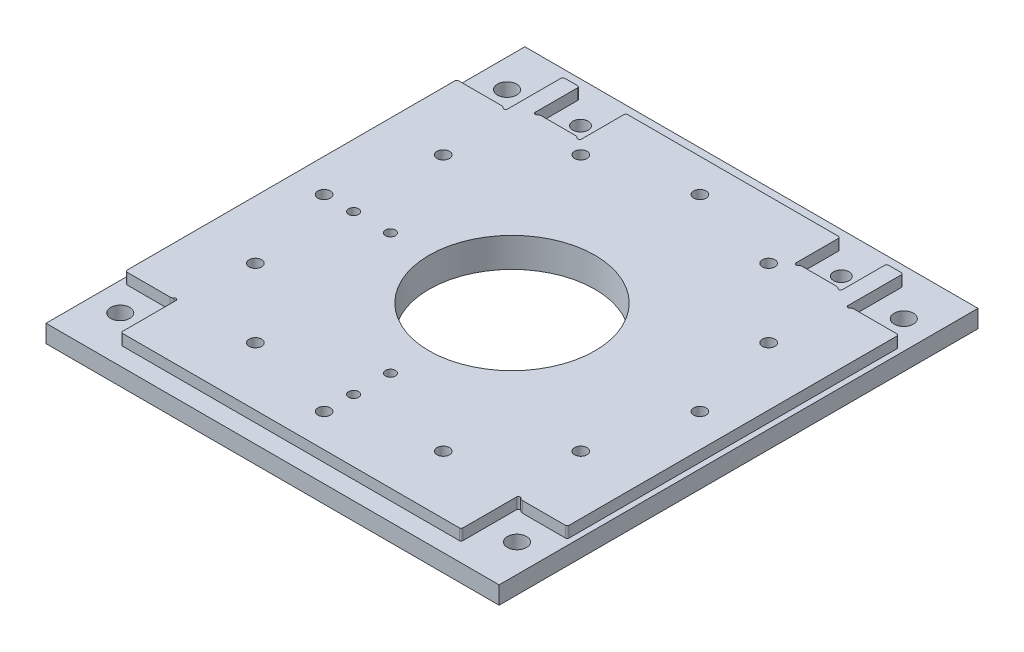
from build123d import *

# Parameters (mm, degrees)
SKETCH_1_W           = 120
SKETCH_1_H           = 120
EXTRUDE_1_DEPTH      = 3
SKETCH_2_W           = 123
SKETCH_2_H           = 128
EXTRUDE_2_DEPTH      = 5
SKETCH_4_R           = 22.5
CUT_EXTRUDE_2_DEPTH  = 90.119302062
SKETCH_5_W           = 15.3
SKETCH_5_H           = 19
SKETCH_5_W_2         = 12.6
SKETCH_5_H_2         = 16
CUT_EXTRUDE_3_DEPTH  = 3
SKETCH_3_R           = 1.7
CUT_EXTRUDE_5_DEPTH  = 90.119302062
SKETCH_15_R          = 1.35
CUT_EXTRUDE_7_DEPTH  = 90.119302062
SKETCH_20_R          = 2.6
SKETCH_20_R_2        = 2.1
CUT_EXTRUDE_14_DEPTH = 90.119302062
SKETCH_21_R          = 5.5
SKETCH_21_R_2        = 4.6
CUT_EXTRUDE_15_DEPTH = 1
SKETCH_23_W          = 1
SKETCH_23_H          = 5
EXTRUDE_5_DEPTH      = 123
FILLET_1_R           = 0.5
SKETCH_25_R          = 0.5
CUT_EXTRUDE_17_DEPTH = 3
FILLET_2_R           = 1
CHAMFER_1_SIZE       = 0.2


with BuildPart() as part:
    # 草图1 → 凸台-拉伸1 (new body)
    with BuildSketch(Plane(origin=(0, 0, 0), x_dir=(1, 0, 0), z_dir=(0, 1, 0))):
        Rectangle(SKETCH_1_W, SKETCH_1_H)
    extrude(amount=EXTRUDE_1_DEPTH)

    # 草图2 → 凸台-拉伸2 (add)
    with BuildSketch(Plane.XZ):
        Rectangle(SKETCH_2_W, SKETCH_2_H)
    extrude(amount=EXTRUDE_2_DEPTH)

    # 草图4 → 切除-拉伸2 (cut, through all)
    with BuildSketch(Plane(origin=(0, 3, 0), x_dir=(1, 0, 0), z_dir=(0, 1, 0))):
        with Locations(Location((0, 0, 0), (0, 0, 270))):
            Circle(SKETCH_4_R)
    extrude(amount=-CUT_EXTRUDE_2_DEPTH, mode=Mode.SUBTRACT)

    # 草图5 → 切除-拉伸3 (cut)
    with BuildSketch(Plane(origin=(0, 3, 0), x_dir=(1, 0, 0), z_dir=(0, 1, 0))):
        with Locations((-53.85, 54.5)):
            Rectangle(SKETCH_5_W, SKETCH_5_H)
        with Locations((35.4, 56)):
            Rectangle(SKETCH_5_W_2, SKETCH_5_H_2)
        with Locations((53.85, 54.5)):
            Rectangle(SKETCH_5_W, SKETCH_5_H)
        with Locations((-35.4, 56)):
            Rectangle(SKETCH_5_W_2, SKETCH_5_H_2)
        with Locations((-53.85, -54.5)):
            Rectangle(SKETCH_5_W, SKETCH_5_H)
        with Locations((53.85, -54.5)):
            Rectangle(SKETCH_5_W, SKETCH_5_H)
    extrude(amount=-CUT_EXTRUDE_3_DEPTH, mode=Mode.SUBTRACT)

    # 草图3 → 切除-拉伸5 (cut, through all)
    with BuildSketch(Plane(origin=(0, 3, 0), x_dir=(1, 0, 0), z_dir=(0, 1, 0))):
        with Locations(Location((0, 51, 0), (0, 0, 270))):
            Circle(SKETCH_3_R)
        with Locations(Location((25.5, 44.167295593, 0), (0, 0, 270))):
            Circle(SKETCH_3_R)
        with Locations(Location((44.167295593, 25.5, 0), (0, 0, 270))):
            Circle(SKETCH_3_R)
        with Locations(Location((51, 0, 0), (0, 0, 270))):
            Circle(SKETCH_3_R)
        with Locations(Location((44.167295593, -25.5, 0), (0, 0, 270))):
            Circle(SKETCH_3_R)
        with Locations(Location((25.5, -44.167295593, 0), (0, 0, 270))):
            Circle(SKETCH_3_R)
        with Locations(Location((0, -51, 0), (0, 0, 270))):
            Circle(SKETCH_3_R)
        with Locations(Location((-25.5, -44.167295593, 0), (0, 0, 270))):
            Circle(SKETCH_3_R)
        with Locations(Location((-44.167295593, -25.5, 0), (0, 0, 270))):
            Circle(SKETCH_3_R)
        with Locations(Location((-51, 0, 0), (0, 0, 270))):
            Circle(SKETCH_3_R)
        with Locations(Location((-44.167295593, 25.5, 0), (0, 0, 270))):
            Circle(SKETCH_3_R)
        with Locations(Location((-25.5, 44.167295593, 0), (0, 0, 270))):
            Circle(SKETCH_3_R)
    extrude(amount=-CUT_EXTRUDE_5_DEPTH, mode=Mode.SUBTRACT)

    # 草图15 → 切除-拉伸7 (cut, through all)
    with BuildSketch(Plane(origin=(0, 3, 0), x_dir=(1, 0, 0), z_dir=(0, 1, 0))):
        with Locations(Location((0, -33, 0), (0, 0, 270))):
            Circle(SKETCH_15_R)
        with Locations(Location((0, -43, 0), (0, 0, 270))):
            Circle(SKETCH_15_R)
        with Locations(Location((-33, 0, 0), (0, 0, 270))):
            Circle(SKETCH_15_R)
        with Locations(Location((-43, 0, 0), (0, 0, 270))):
            Circle(SKETCH_15_R)
    extrude(amount=-CUT_EXTRUDE_7_DEPTH, mode=Mode.SUBTRACT)

    # 草图20 → 切除-拉伸14 (cut, through all)
    with BuildSketch(Plane(origin=(0, 3, 0), x_dir=(1, 0, 0), z_dir=(0, 1, 0))):
        with Locations(Location((-53.85, 52.5, 0), (0, 0, 270))):
            Circle(SKETCH_20_R)
        with Locations(Location((-53.85, -52.5, 0), (0, 0, 270))):
            Circle(SKETCH_20_R)
        with Locations(Location((53.85, -52.5, 0), (0, 0, 270))):
            Circle(SKETCH_20_R)
        with Locations(Location((53.85, 52.5, 0), (0, 0, 270))):
            Circle(SKETCH_20_R)
        with Locations(Location((-35.4, 54, 0), (0, 0, 270))):
            Circle(SKETCH_20_R_2)
        with Locations(Location((35.4, 54, 0), (0, 0, 270))):
            Circle(SKETCH_20_R_2)
    extrude(amount=-CUT_EXTRUDE_14_DEPTH, mode=Mode.SUBTRACT)

    # 草图21 → 切除-拉伸15 (cut)
    with BuildSketch(Plane.XZ.offset(5)):
        with Locations(Location((53.85, -52.5, 0), (0, 0, 270))):
            Circle(SKETCH_21_R)
        with Locations(Location((35.4, -54, 0), (0, 0, 270))):
            Circle(SKETCH_21_R_2)
        with Locations(Location((-35.4, -54, 0), (0, 0, 270))):
            Circle(SKETCH_21_R_2)
        with Locations(Location((-53.85, -52.5, 0), (0, 0, 270))):
            Circle(SKETCH_21_R)
        with Locations(Location((-53.85, 52.5, 0), (0, 0, 270))):
            Circle(SKETCH_21_R)
        with Locations(Location((53.85, 52.5, 0), (0, 0, 270))):
            Circle(SKETCH_21_R)
    extrude(amount=-CUT_EXTRUDE_15_DEPTH, mode=Mode.SUBTRACT)

    # 草图23 → 凸台-拉伸5 (add)
    with BuildSketch(Plane.ZY.offset(61.5)):
        with Locations((-64.5, -2.5)):
            Rectangle(SKETCH_23_W, SKETCH_23_H)
        with Locations((64.5, -2.5)):
            Rectangle(SKETCH_23_W, SKETCH_23_H)
    extrude(amount=-EXTRUDE_5_DEPTH)

    # 圆角1
    fillet_1_edges = [part.edges().sort_by_distance(p)[0] for p in [
        (46.2, 1.5, 60),
        (60, 1.5, 45),
        (-46.2, 1.5, -60),
        (-60, 1.5, -45),
        (-60, 1.5, 45),
        (-46.2, 1.5, 60),
        (41.7, 1.5, -60),
        (29.1, 1.5, -60),
        (-29.1, 1.5, -60),
        (-41.7, 1.5, -60),
        (60, 1.5, -45),
        (46.2, 1.5, -60),
    ]]
    fillet(fillet_1_edges, radius=FILLET_1_R)

    # 草图25 → 切除-拉伸17 (cut)
    with BuildSketch(Plane(origin=(0, 3, 0), x_dir=(1, 0, 0), z_dir=(0, 1, 0))):
        with Locations((-46.7, 45)):
            Circle(SKETCH_25_R)
        with Locations((-41.2, 48)):
            Circle(SKETCH_25_R)
        with Locations((41.2, 48)):
            Circle(SKETCH_25_R)
        with Locations((46.7, 45)):
            Circle(SKETCH_25_R)
        with Locations((-46.7, -45)):
            Circle(SKETCH_25_R)
        with Locations((46.7, -45)):
            Circle(SKETCH_25_R)
        with Locations((-29.6, 48)):
            Circle(SKETCH_25_R)
        with Locations((29.6, 48)):
            Circle(SKETCH_25_R)
    extrude(amount=-CUT_EXTRUDE_17_DEPTH, mode=Mode.SUBTRACT)

    # 圆角2
    fillet_2_edges = [part.edges().sort_by_distance(p)[0] for p in [
        (30.1, 1.5, -48),
        (40.7, 1.5, -48),
        (-30.1, 1.5, -48),
        (-40.7, 1.5, -48),
        (47.2, 1.5, 45),
        (-47.2, 1.5, -45),
        (47.2, 1.5, -45),
        (-47.2, 1.5, 45),
    ]]
    fillet(fillet_2_edges, radius=FILLET_2_R)

    # 倒角1
    chamfer_1_edges = [part.edges().sort_by_distance(p)[0] for p in [
        (61.5, -5, 0),
        (-61.5, -5, 0),
        (0, -5, -65),
        (0, -5, 65),
    ]]
    chamfer(chamfer_1_edges, length=CHAMFER_1_SIZE)


solid = part.part
